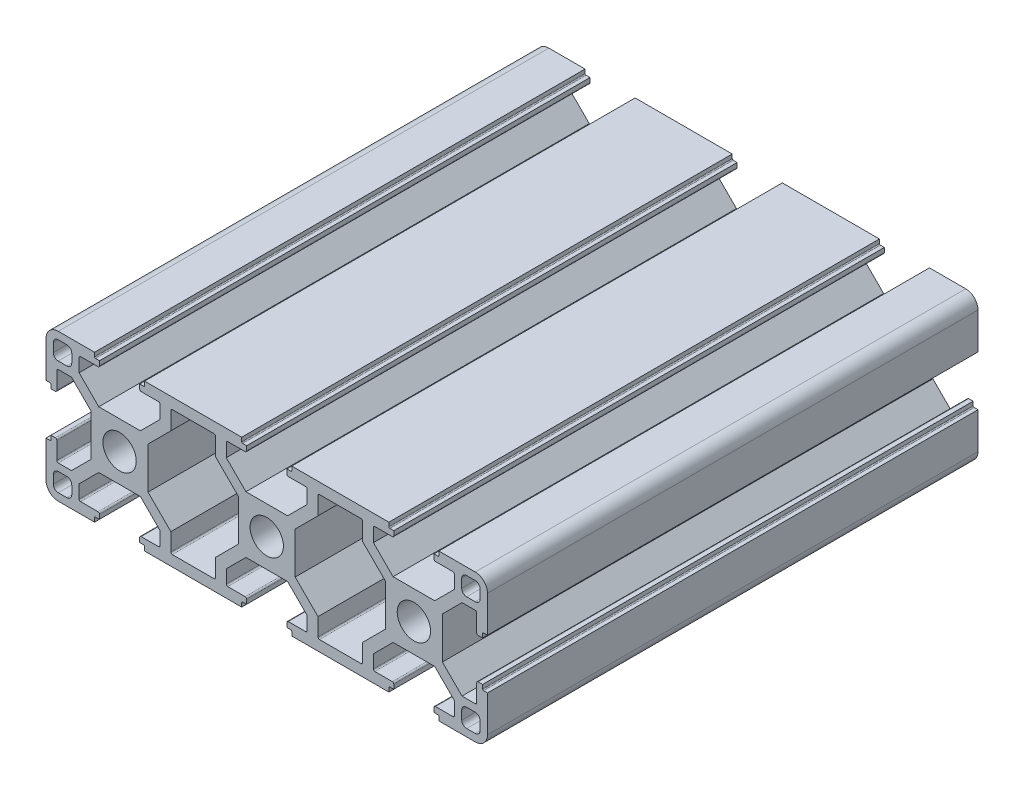
from build123d import *

# Parameters (mm, degrees)
SKETCH_1_R      = 3.4
EXTRUDE_1_DEPTH = 100


with BuildPart() as part:
    # 草图1 → 凸台-拉伸1 (new body)
    with BuildSketch(Plane.XY):
        with BuildLine():
            Line((-28.893763523, 17.821251719), (-36.293763523, 17.821251719))
            Line((-36.293763523, 17.821251719), (-36.293763523, 17.021251719))
            ThreePointArc((-36.293763523, 17.021251719), (-36.352342167, 16.879830363), (-36.493763523, 16.821251719))
            Line((-36.493763523, 16.821251719), (-37.293763523, 16.821251719))
            Line((-37.293763523, 16.821251719), (-37.293763523, 15.921251719))
            ThreePointArc((-37.293763523, 15.921251719), (-37.205895557, 15.709119685), (-36.993763523, 15.621251719))
            Line((-36.993763523, 15.621251719), (-33.443763523, 15.621251719))
            ThreePointArc((-33.443763523, 15.621251719), (-33.231631488, 15.533383754), (-33.143763523, 15.321251719))
            Line((-33.143763523, 15.321251719), (-33.143763523, 12.626886638))
            Line((-33.143763523, 12.626886638), (-37.149398441, 8.621251719))
            Line((-37.149398441, 8.621251719), (-45.638128604, 8.621251719))
            Line((-45.638128604, 8.621251719), (-49.643763523, 12.626886638))
            Line((-49.643763523, 12.626886638), (-49.643763523, 15.321251719))
            ThreePointArc((-49.643763523, 15.321251719), (-49.555895557, 15.533383754), (-49.343763523, 15.621251719))
            Line((-49.343763523, 15.621251719), (-45.793763523, 15.621251719))
            ThreePointArc((-45.793763523, 15.621251719), (-45.581631488, 15.709119685), (-45.493763523, 15.921251719))
            Line((-45.493763523, 15.921251719), (-45.493763523, 16.821251719))
            Line((-45.493763523, 16.821251719), (-46.293763523, 16.821251719))
            ThreePointArc((-46.293763523, 16.821251719), (-46.435184879, 16.879830363), (-46.493763523, 17.021251719))
            Line((-46.493763523, 17.021251719), (-46.493763523, 17.821251719))
            Line((-46.493763523, 17.821251719), (-53.893763523, 17.821251719))
            ThreePointArc((-53.893763523, 17.821251719), (-55.661530476, 17.089018672), (-56.393763523, 15.321251719))
            Line((-56.393763523, 15.321251719), (-56.393763523, 7.921251719))
            Line((-56.393763523, 7.921251719), (-55.593763523, 7.921251719))
            ThreePointArc((-55.593763523, 7.921251719), (-55.452342167, 7.862673076), (-55.393763523, 7.721251719))
            Line((-55.393763523, 7.721251719), (-55.393763523, 6.921251719))
            Line((-55.393763523, 6.921251719), (-54.493763523, 6.921251719))
            ThreePointArc((-54.493763523, 6.921251719), (-54.281631488, 7.009119685), (-54.193763523, 7.221251719))
            Line((-54.193763523, 7.221251719), (-54.193763523, 10.771251719))
            ThreePointArc((-54.193763523, 10.771251719), (-54.105895557, 10.983383754), (-53.893763523, 11.071251719))
            Line((-53.893763523, 11.071251719), (-51.199398441, 11.071251719))
            Line((-51.199398441, 11.071251719), (-47.193763523, 7.065616801))
            Line((-47.193763523, 7.065616801), (-47.193763523, -1.423113362))
            Line((-47.193763523, -1.423113362), (-51.199398441, -5.428748281))
            Line((-51.199398441, -5.428748281), (-53.893763523, -5.428748281))
            ThreePointArc((-53.893763523, -5.428748281), (-54.105895557, -5.340880315), (-54.193763523, -5.128748281))
            Line((-54.193763523, -5.128748281), (-54.193763523, -1.578748281))
            ThreePointArc((-54.193763523, -1.578748281), (-54.281631488, -1.366616246), (-54.493763523, -1.278748281))
            Line((-54.493763523, -1.278748281), (-55.393763523, -1.278748281))
            Line((-55.393763523, -1.278748281), (-55.393763523, -2.078748281))
            ThreePointArc((-55.393763523, -2.078748281), (-55.452342167, -2.220169637), (-55.593763523, -2.278748281))
            Line((-55.593763523, -2.278748281), (-56.393763523, -2.278748281))
            Line((-56.393763523, -2.278748281), (-56.393763523, -9.678748281))
            ThreePointArc((-56.393763523, -9.678748281), (-55.661530476, -11.446515234), (-53.893763523, -12.178748281))
            Line((-53.893763523, -12.178748281), (-46.493763523, -12.178748281))
            Line((-46.493763523, -12.178748281), (-46.493763523, -11.378748281))
            ThreePointArc((-46.493763523, -11.378748281), (-46.435184879, -11.237326924), (-46.293763523, -11.178748281))
            Line((-46.293763523, -11.178748281), (-45.493763523, -11.178748281))
            Line((-45.493763523, -11.178748281), (-45.493763523, -10.278748281))
            ThreePointArc((-45.493763523, -10.278748281), (-45.581631488, -10.066616246), (-45.793763523, -9.978748281))
            Line((-45.793763523, -9.978748281), (-49.343763523, -9.978748281))
            ThreePointArc((-49.343763523, -9.978748281), (-49.555895557, -9.890880315), (-49.643763523, -9.678748281))
            Line((-49.643763523, -9.678748281), (-49.643763523, -6.984383199))
            Line((-49.643763523, -6.984383199), (-45.638128604, -2.978748281))
            Line((-45.638128604, -2.978748281), (-37.149398441, -2.978748281))
            Line((-37.149398441, -2.978748281), (-33.143763523, -6.984383199))
            Line((-33.143763523, -6.984383199), (-33.143763523, -9.678748281))
            ThreePointArc((-33.143763523, -9.678748281), (-33.231631488, -9.890880315), (-33.443763523, -9.978748281))
            Line((-33.443763523, -9.978748281), (-36.993763523, -9.978748281))
            ThreePointArc((-36.993763523, -9.978748281), (-37.205895557, -10.066616246), (-37.293763523, -10.278748281))
            Line((-37.293763523, -10.278748281), (-37.293763523, -11.178748281))
            Line((-37.293763523, -11.178748281), (-36.493763523, -11.178748281))
            ThreePointArc((-36.493763523, -11.178748281), (-36.352342167, -11.237326924), (-36.293763523, -11.378748281))
            Line((-36.293763523, -11.378748281), (-36.293763523, -12.178748281))
            Line((-36.293763523, -12.178748281), (-28.893763523, -12.178748281))
            Line((-28.893763523, -12.178748281), (-23.893763523, -12.178748281))
            Line((-23.893763523, -12.178748281), (-16.493763523, -12.178748281))
            Line((-16.493763523, -12.178748281), (-16.493763523, -11.378748281))
            ThreePointArc((-16.493763523, -11.378748281), (-16.435184879, -11.237326924), (-16.293763523, -11.178748281))
            Line((-16.293763523, -11.178748281), (-15.493763523, -11.178748281))
            Line((-15.493763523, -11.178748281), (-15.493763523, -10.278748281))
            ThreePointArc((-15.493763523, -10.278748281), (-15.581631488, -10.066616246), (-15.793763523, -9.978748281))
            Line((-15.793763523, -9.978748281), (-19.343763523, -9.978748281))
            ThreePointArc((-19.343763523, -9.978748281), (-19.555895557, -9.890880315), (-19.643763523, -9.678748281))
            Line((-19.643763523, -9.678748281), (-19.643763523, -6.984383199))
            Line((-19.643763523, -6.984383199), (-15.638128604, -2.978748281))
            Line((-15.638128604, -2.978748281), (-7.149398441, -2.978748281))
            Line((-7.149398441, -2.978748281), (-3.143763523, -6.984383199))
            Line((-3.143763523, -6.984383199), (-3.143763523, -9.678748281))
            ThreePointArc((-3.143763523, -9.678748281), (-3.231631488, -9.890880315), (-3.443763523, -9.978748281))
            Line((-3.443763523, -9.978748281), (-6.993763523, -9.978748281))
            ThreePointArc((-6.993763523, -9.978748281), (-7.205895557, -10.066616246), (-7.293763523, -10.278748281))
            Line((-7.293763523, -10.278748281), (-7.293763523, -11.178748281))
            Line((-7.293763523, -11.178748281), (-6.493763523, -11.178748281))
            ThreePointArc((-6.493763523, -11.178748281), (-6.352342167, -11.237326924), (-6.293763523, -11.378748281))
            Line((-6.293763523, -11.378748281), (-6.293763523, -12.178748281))
            Line((-6.293763523, -12.178748281), (13.506236477, -12.178748281))
            Line((13.506236477, -12.178748281), (13.506236477, -11.378748281))
            ThreePointArc((13.506236477, -11.378748281), (13.564815121, -11.237326924), (13.706236477, -11.178748281))
            Line((13.706236477, -11.178748281), (14.506236477, -11.178748281))
            Line((14.506236477, -11.178748281), (14.506236477, -10.278748281))
            ThreePointArc((14.506236477, -10.278748281), (14.418368512, -10.066616246), (14.206236477, -9.978748281))
            Line((14.206236477, -9.978748281), (10.656236477, -9.978748281))
            ThreePointArc((10.656236477, -9.978748281), (10.444104443, -9.890880315), (10.356236477, -9.678748281))
            Line((10.356236477, -9.678748281), (10.356236477, -6.984383199))
            Line((10.356236477, -6.984383199), (14.361871396, -2.978748281))
            Line((14.361871396, -2.978748281), (22.850601559, -2.978748281))
            Line((22.850601559, -2.978748281), (26.856236477, -6.984383199))
            Line((26.856236477, -6.984383199), (26.856236477, -9.678748281))
            ThreePointArc((26.856236477, -9.678748281), (26.768368512, -9.890880315), (26.556236477, -9.978748281))
            Line((26.556236477, -9.978748281), (23.006236477, -9.978748281))
            ThreePointArc((23.006236477, -9.978748281), (22.794104443, -10.066616246), (22.706236477, -10.278748281))
            Line((22.706236477, -10.278748281), (22.706236477, -11.178748281))
            Line((22.706236477, -11.178748281), (23.506236477, -11.178748281))
            ThreePointArc((23.506236477, -11.178748281), (23.647657833, -11.237326924), (23.706236477, -11.378748281))
            Line((23.706236477, -11.378748281), (23.706236477, -12.178748281))
            Line((23.706236477, -12.178748281), (31.106236477, -12.178748281))
            ThreePointArc((31.106236477, -12.178748281), (32.87400343, -11.446515234), (33.606236477, -9.678748281))
            Line((33.606236477, -9.678748281), (33.606236477, -2.278748281))
            Line((33.606236477, -2.278748281), (32.806236477, -2.278748281))
            ThreePointArc((32.806236477, -2.278748281), (32.664815121, -2.220169637), (32.606236477, -2.078748281))
            Line((32.606236477, -2.078748281), (32.606236477, -1.278748281))
            Line((32.606236477, -1.278748281), (31.706236477, -1.278748281))
            ThreePointArc((31.706236477, -1.278748281), (31.494104443, -1.366616246), (31.406236477, -1.578748281))
            Line((31.406236477, -1.578748281), (31.406236477, -5.128748281))
            ThreePointArc((31.406236477, -5.128748281), (31.318368512, -5.340880315), (31.106236477, -5.428748281))
            Line((31.106236477, -5.428748281), (28.411871396, -5.428748281))
            Line((28.411871396, -5.428748281), (24.406236477, -1.423113362))
            Line((24.406236477, -1.423113362), (24.406236477, 7.065616801))
            Line((24.406236477, 7.065616801), (28.411871396, 11.071251719))
            Line((28.411871396, 11.071251719), (31.106236477, 11.071251719))
            ThreePointArc((31.106236477, 11.071251719), (31.318368512, 10.983383754), (31.406236477, 10.771251719))
            Line((31.406236477, 10.771251719), (31.406236477, 7.221251719))
            ThreePointArc((31.406236477, 7.221251719), (31.494104443, 7.009119685), (31.706236477, 6.921251719))
            Line((31.706236477, 6.921251719), (32.606236477, 6.921251719))
            Line((32.606236477, 6.921251719), (32.606236477, 7.721251719))
            ThreePointArc((32.606236477, 7.721251719), (32.664815121, 7.862673076), (32.806236477, 7.921251719))
            Line((32.806236477, 7.921251719), (33.606236477, 7.921251719))
            Line((33.606236477, 7.921251719), (33.606236477, 15.321251719))
            ThreePointArc((33.606236477, 15.321251719), (32.87400343, 17.089018672), (31.106236477, 17.821251719))
            Line((31.106236477, 17.821251719), (23.706236477, 17.821251719))
            Line((23.706236477, 17.821251719), (23.706236477, 17.021251719))
            ThreePointArc((23.706236477, 17.021251719), (23.647657833, 16.879830363), (23.506236477, 16.821251719))
            Line((23.506236477, 16.821251719), (22.706236477, 16.821251719))
            Line((22.706236477, 16.821251719), (22.706236477, 15.921251719))
            ThreePointArc((22.706236477, 15.921251719), (22.794104443, 15.709119685), (23.006236477, 15.621251719))
            Line((23.006236477, 15.621251719), (26.556236477, 15.621251719))
            ThreePointArc((26.556236477, 15.621251719), (26.768368512, 15.533383754), (26.856236477, 15.321251719))
            Line((26.856236477, 15.321251719), (26.856236477, 12.626886638))
            Line((26.856236477, 12.626886638), (22.850601559, 8.621251719))
            Line((22.850601559, 8.621251719), (14.361871396, 8.621251719))
            Line((14.361871396, 8.621251719), (10.356236477, 12.626886638))
            Line((10.356236477, 12.626886638), (10.356236477, 15.321251719))
            ThreePointArc((10.356236477, 15.321251719), (10.444104443, 15.533383754), (10.656236477, 15.621251719))
            Line((10.656236477, 15.621251719), (14.206236477, 15.621251719))
            ThreePointArc((14.206236477, 15.621251719), (14.418368512, 15.709119685), (14.506236477, 15.921251719))
            Line((14.506236477, 15.921251719), (14.506236477, 16.821251719))
            Line((14.506236477, 16.821251719), (13.706236477, 16.821251719))
            ThreePointArc((13.706236477, 16.821251719), (13.564815121, 16.879830363), (13.506236477, 17.021251719))
            Line((13.506236477, 17.021251719), (13.506236477, 17.821251719))
            Line((13.506236477, 17.821251719), (-6.293763523, 17.821251719))
            Line((-6.293763523, 17.821251719), (-6.293763523, 17.021251719))
            ThreePointArc((-6.293763523, 17.021251719), (-6.352342167, 16.879830363), (-6.493763523, 16.821251719))
            Line((-6.493763523, 16.821251719), (-7.293763523, 16.821251719))
            Line((-7.293763523, 16.821251719), (-7.293763523, 15.921251719))
            ThreePointArc((-7.293763523, 15.921251719), (-7.205895557, 15.709119685), (-6.993763523, 15.621251719))
            Line((-6.993763523, 15.621251719), (-3.443763523, 15.621251719))
            ThreePointArc((-3.443763523, 15.621251719), (-3.231631488, 15.533383754), (-3.143763523, 15.321251719))
            Line((-3.143763523, 15.321251719), (-3.143763523, 12.626886638))
            Line((-3.143763523, 12.626886638), (-7.149398441, 8.621251719))
            Line((-7.149398441, 8.621251719), (-15.638128604, 8.621251719))
            Line((-15.638128604, 8.621251719), (-19.643763523, 12.626886638))
            Line((-19.643763523, 12.626886638), (-19.643763523, 15.321251719))
            ThreePointArc((-19.643763523, 15.321251719), (-19.555895557, 15.533383754), (-19.343763523, 15.621251719))
            Line((-19.343763523, 15.621251719), (-15.793763523, 15.621251719))
            ThreePointArc((-15.793763523, 15.621251719), (-15.581631488, 15.709119685), (-15.493763523, 15.921251719))
            Line((-15.493763523, 15.921251719), (-15.493763523, 16.821251719))
            Line((-15.493763523, 16.821251719), (-16.293763523, 16.821251719))
            ThreePointArc((-16.293763523, 16.821251719), (-16.435184879, 16.879830363), (-16.493763523, 17.021251719))
            Line((-16.493763523, 17.021251719), (-16.493763523, 17.821251719))
            Line((-16.493763523, 17.821251719), (-23.893763523, 17.821251719))
            Line((-23.893763523, 17.821251719), (-28.893763523, 17.821251719))
        make_face()
        with Locations((18.606236477, 2.821251719)):
            Circle(SKETCH_1_R, mode=Mode.SUBTRACT)
        with Locations((-11.393763523, 2.821251719)):
            Circle(SKETCH_1_R, mode=Mode.SUBTRACT)
        with Locations((-41.393763523, 2.821251719)):
            Circle(SKETCH_1_R, mode=Mode.SUBTRACT)
        with BuildLine():
            Line((-51.143763523, -7.928748281), (-51.143763523, -9.678748281))
            ThreePointArc((-51.143763523, -9.678748281), (-51.436656742, -10.385855062), (-52.143763523, -10.678748281))
            Line((-52.143763523, -10.678748281), (-53.893763523, -10.678748281))
            ThreePointArc((-53.893763523, -10.678748281), (-54.600870304, -10.385855062), (-54.893763523, -9.678748281))
            Line((-54.893763523, -9.678748281), (-54.893763523, -7.928748281))
            ThreePointArc((-54.893763523, -7.928748281), (-54.600870304, -7.221641499), (-53.893763523, -6.928748281))
            Line((-53.893763523, -6.928748281), (-52.143763523, -6.928748281))
            ThreePointArc((-52.143763523, -6.928748281), (-51.436656742, -7.221641499), (-51.143763523, -7.928748281))
        make_face(mode=Mode.SUBTRACT)
        with BuildLine():
            Line((-52.143763523, 12.571251719), (-53.893763523, 12.571251719))
            ThreePointArc((-53.893763523, 12.571251719), (-54.600870304, 12.864144938), (-54.893763523, 13.571251719))
            Line((-54.893763523, 13.571251719), (-54.893763523, 15.321251719))
            ThreePointArc((-54.893763523, 15.321251719), (-54.600870304, 16.028358501), (-53.893763523, 16.321251719))
            Line((-53.893763523, 16.321251719), (-52.143763523, 16.321251719))
            ThreePointArc((-52.143763523, 16.321251719), (-51.436656742, 16.028358501), (-51.143763523, 15.321251719))
            Line((-51.143763523, 15.321251719), (-51.143763523, 13.571251719))
            ThreePointArc((-51.143763523, 13.571251719), (-51.436656742, 12.864144938), (-52.143763523, 12.571251719))
        make_face(mode=Mode.SUBTRACT)
        with BuildLine():
            Line((-30.943763523, -6.073113362), (-35.593763523, -1.423113362))
            Line((-35.593763523, -1.423113362), (-35.593763523, 7.065616801))
            Line((-35.593763523, 7.065616801), (-30.943763523, 11.715616801))
            Line((-30.943763523, 11.715616801), (-30.943763523, 15.321251719))
            ThreePointArc((-30.943763523, 15.321251719), (-30.855895557, 15.533383754), (-30.643763523, 15.621251719))
            Line((-30.643763523, 15.621251719), (-22.143763523, 15.621251719))
            ThreePointArc((-22.143763523, 15.621251719), (-21.931631488, 15.533383754), (-21.843763523, 15.321251719))
            Line((-21.843763523, 15.321251719), (-21.843763523, 11.715616801))
            Line((-21.843763523, 11.715616801), (-17.193763523, 7.065616801))
            Line((-17.193763523, 7.065616801), (-17.193763523, -1.423113362))
            Line((-17.193763523, -1.423113362), (-21.843763523, -6.073113362))
            Line((-21.843763523, -6.073113362), (-21.843763523, -9.678748281))
            ThreePointArc((-21.843763523, -9.678748281), (-21.931631488, -9.890880315), (-22.143763523, -9.978748281))
            Line((-22.143763523, -9.978748281), (-30.643763523, -9.978748281))
            ThreePointArc((-30.643763523, -9.978748281), (-30.855895557, -9.890880315), (-30.943763523, -9.678748281))
            Line((-30.943763523, -9.678748281), (-30.943763523, -6.073113362))
        make_face(mode=Mode.SUBTRACT)
        with BuildLine():
            Line((-5.593763523, -1.423113362), (-5.593763523, 7.065616801))
            Line((-5.593763523, 7.065616801), (-0.943763523, 11.715616801))
            Line((-0.943763523, 11.715616801), (-0.943763523, 15.321251719))
            ThreePointArc((-0.943763523, 15.321251719), (-0.855895557, 15.533383754), (-0.643763523, 15.621251719))
            Line((-0.643763523, 15.621251719), (7.856236477, 15.621251719))
            ThreePointArc((7.856236477, 15.621251719), (8.068368512, 15.533383754), (8.156236477, 15.321251719))
            Line((8.156236477, 15.321251719), (8.156236477, 11.715616801))
            Line((8.156236477, 11.715616801), (12.806236477, 7.065616801))
            Line((12.806236477, 7.065616801), (12.806236477, -1.423113362))
            Line((12.806236477, -1.423113362), (8.156236477, -6.073113362))
            Line((8.156236477, -6.073113362), (8.156236477, -9.678748281))
            ThreePointArc((8.156236477, -9.678748281), (8.068368512, -9.890880315), (7.856236477, -9.978748281))
            Line((7.856236477, -9.978748281), (-0.643763523, -9.978748281))
            ThreePointArc((-0.643763523, -9.978748281), (-0.855895557, -9.890880315), (-0.943763523, -9.678748281))
            Line((-0.943763523, -9.678748281), (-0.943763523, -6.073113362))
            Line((-0.943763523, -6.073113362), (-5.593763523, -1.423113362))
        make_face(mode=Mode.SUBTRACT)
        with BuildLine():
            Line((29.356236477, -6.928748281), (31.106236477, -6.928748281))
            ThreePointArc((31.106236477, -6.928748281), (31.813343258, -7.221641499), (32.106236477, -7.928748281))
            Line((32.106236477, -7.928748281), (32.106236477, -9.678748281))
            ThreePointArc((32.106236477, -9.678748281), (31.813343258, -10.385855062), (31.106236477, -10.678748281))
            Line((31.106236477, -10.678748281), (29.356236477, -10.678748281))
            ThreePointArc((29.356236477, -10.678748281), (28.649129696, -10.385855062), (28.356236477, -9.678748281))
            Line((28.356236477, -9.678748281), (28.356236477, -7.928748281))
            ThreePointArc((28.356236477, -7.928748281), (28.649129696, -7.221641499), (29.356236477, -6.928748281))
        make_face(mode=Mode.SUBTRACT)
        with BuildLine():
            Line((28.356236477, 13.571251719), (28.356236477, 15.321251719))
            ThreePointArc((28.356236477, 15.321251719), (28.649129696, 16.028358501), (29.356236477, 16.321251719))
            Line((29.356236477, 16.321251719), (31.106236477, 16.321251719))
            ThreePointArc((31.106236477, 16.321251719), (31.813343258, 16.028358501), (32.106236477, 15.321251719))
            Line((32.106236477, 15.321251719), (32.106236477, 13.571251719))
            ThreePointArc((32.106236477, 13.571251719), (31.813343258, 12.864144938), (31.106236477, 12.571251719))
            Line((31.106236477, 12.571251719), (29.356236477, 12.571251719))
            ThreePointArc((29.356236477, 12.571251719), (28.649129696, 12.864144938), (28.356236477, 13.571251719))
        make_face(mode=Mode.SUBTRACT)
    extrude(amount=EXTRUDE_1_DEPTH)


solid = part.part
